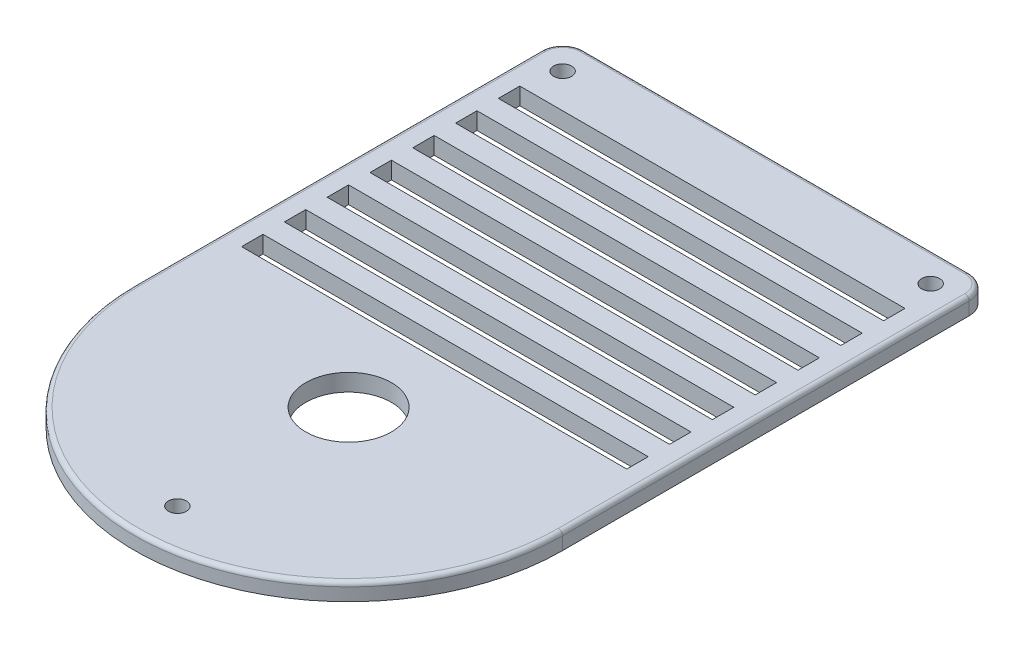
from build123d import *

# Parameters (mm, degrees)
EXTRUDE_1_DEPTH     = 4
SKETCH_3_R          = 2.1
CUT_EXTRUDE_1_DEPTH = 4
SKETCH_4_R          = 10
CUT_EXTRUDE_2_DEPTH = 4
SKETCH_5_W          = 90
SKETCH_5_H          = 5
CUT_EXTRUDE_3_DEPTH = 5
FILLET_1_R          = 5
FILLET_2_R          = 1


with BuildPart() as part:
    # 草图2 → 凸台-拉伸1 (new body)
    with BuildSketch(Plane(origin=(0, 0, 0), x_dir=(1, 0, 0), z_dir=(0, 1, 0))):
        with BuildLine():
            Line((-50, -50), (-50, 50))
            Line((-50, 50), (50, 50))
            Line((50, 50), (50, -50))
            ThreePointArc((50, -50), (0, -100), (-50, -50))
        make_face()
    extrude(amount=EXTRUDE_1_DEPTH)

    # 草图3 → 切除-拉伸1 (cut)
    with BuildSketch(Plane.XZ):
        with Locations(Location((0, 90, 0), (0, 0, 270))):
            Circle(SKETCH_3_R)
        with Locations(Location((43, -43, 0), (0, 0, 270))):
            Circle(SKETCH_3_R)
        with Locations(Location((-43, -43, 0), (0, 0, 270))):
            Circle(SKETCH_3_R)
    extrude(amount=-CUT_EXTRUDE_1_DEPTH, mode=Mode.SUBTRACT)

    # 草图4 → 切除-拉伸2 (cut)
    with BuildSketch(Plane(origin=(0, 4, 0), x_dir=(1, 0, 0), z_dir=(0, 1, 0))):
        with Locations(Location((0, -50, 0), (0, 0, 270))):
            Circle(SKETCH_4_R)
    extrude(amount=-CUT_EXTRUDE_2_DEPTH, mode=Mode.SUBTRACT)

    # 草图5 → 切除-拉伸3 (cut)
    with BuildSketch(Plane(origin=(0, 4, 0), x_dir=(1, 0, 0), z_dir=(0, 1, 0))):
        with Locations((0, 32.5)):
            Rectangle(SKETCH_5_W, SKETCH_5_H)
        with Locations((0, 22.5)):
            Rectangle(SKETCH_5_W, SKETCH_5_H)
        with Locations((0, 12.5)):
            Rectangle(SKETCH_5_W, SKETCH_5_H)
        with Locations((0, 2.5)):
            Rectangle(SKETCH_5_W, SKETCH_5_H)
        with Locations((0, -7.5)):
            Rectangle(SKETCH_5_W, SKETCH_5_H)
        with Locations((0, -17.5)):
            Rectangle(SKETCH_5_W, SKETCH_5_H)
        with Locations((0, -27.5)):
            Rectangle(SKETCH_5_W, SKETCH_5_H)
    extrude(amount=-CUT_EXTRUDE_3_DEPTH, mode=Mode.SUBTRACT)

    # 圆角1
    fillet_1_edges = [part.edges().sort_by_distance(p)[0] for p in [
        (-50, 2, -50),
        (50, 2, -50),
    ]]
    fillet(fillet_1_edges, radius=FILLET_1_R)

    # 圆角2
    fillet_2_edges = [part.edges().sort_by_distance(p)[0] for p in [
        (0, 4, 100),
        (0, 4, -50),
        (-50, 4, 2.5),
        (-48.535533906, 4, -48.535533906),
        (48.535533906, 4, -48.535533906),
        (50, 4, 2.5),
    ]]
    fillet(fillet_2_edges, radius=FILLET_2_R)


solid = part.part
